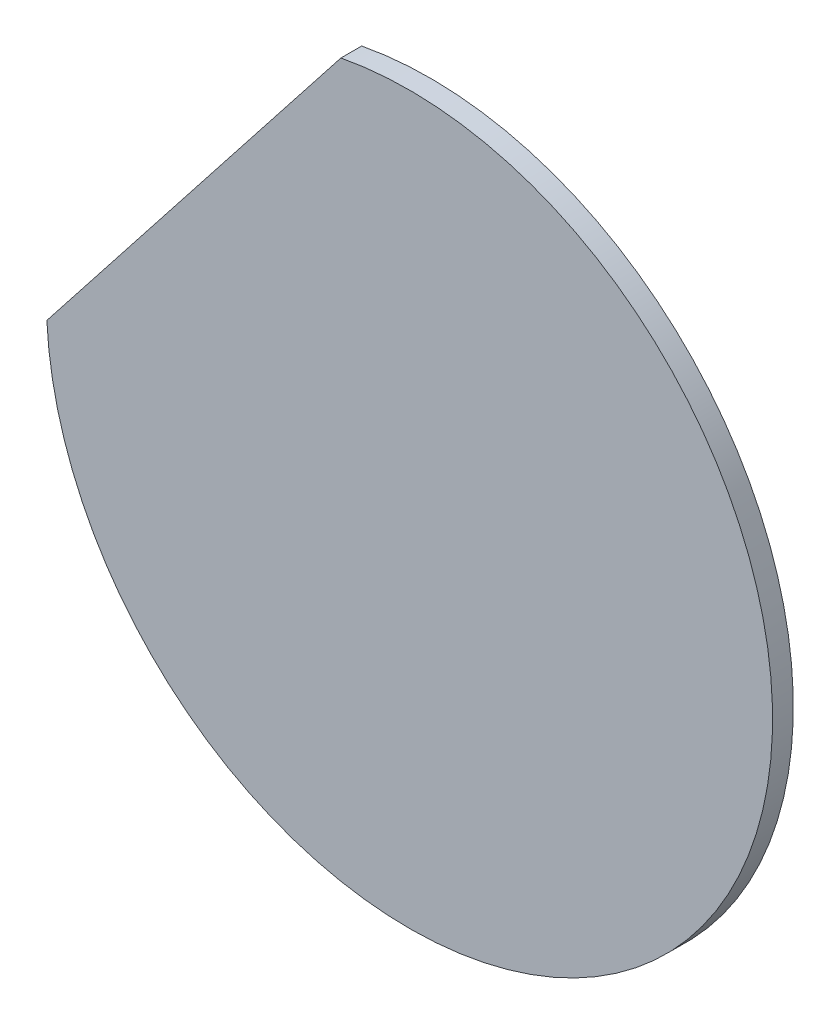
from build123d import *

# Parameters (mm, degrees)
BOSS_EXTRUDE1_DEPTH = 10


with BuildPart() as part:
    # Sketch2 → Boss-Extrude1 (new body)
    with BuildSketch(Plane.XY):
        with BuildLine():
            ThreePointArc((175, 0), (111.44418733, 134.926621207), (-33.059349831, 171.84900171))
            Line((-33.059349831, 171.84900171), (-174.790934379, -8.551564713))
            ThreePointArc((-174.790934379, -8.551564713), (4.277059956, -174.947725787), (175, 0))
        make_face()
    extrude(amount=BOSS_EXTRUDE1_DEPTH)


solid = part.part
